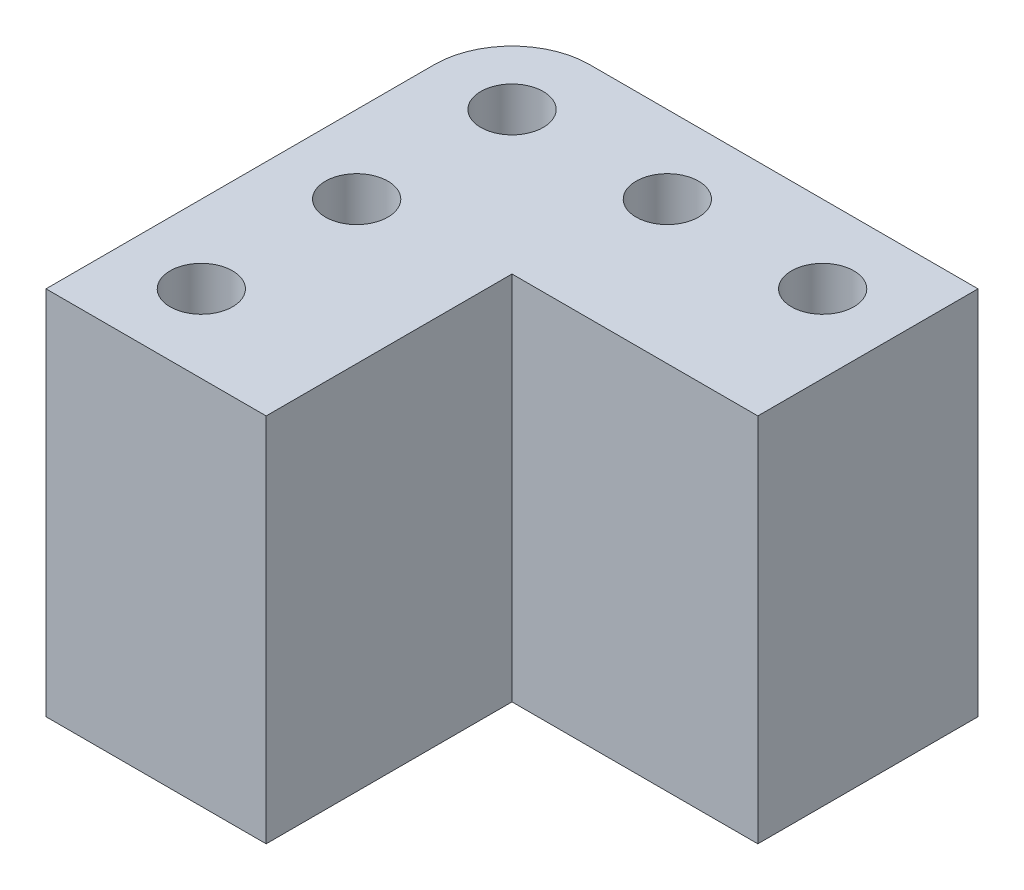
from build123d import *

# Parameters (mm, degrees)
BOSS_EXTRUDE1_DEPTH = 30.3
SKETCH2_R           = 2.5527
CUT_EXTRUDE1_DEPTH  = 62.816745304
CUT_EXTRUDE2_DEPTH  = 62.816745304


with BuildPart() as part:
    # Sketch1 → Boss-Extrude1 (new body)
    with BuildSketch(Plane(origin=(0, 0, 0), x_dir=(1, 0, 0), z_dir=(0, 1, 0))):
        Polygon((0, 0), (38.1, 0), (38.1, -18), (18, -18), (18, -38.1), (0, -38.1), align=None)
    extrude(amount=BOSS_EXTRUDE1_DEPTH)

    # Sketch2 → Cut-Extrude1 (cut, through all)
    with BuildSketch(Plane(origin=(0, 30.3, 0), x_dir=(1, 0, 0), z_dir=(0, 1, 0))):
        with Locations(Location((6.35, -6.35, 0), (0, 0, 270))):
            Circle(SKETCH2_R)
        with Locations(Location((19.05, -6.35, 0), (0, 0, 270))):
            Circle(SKETCH2_R)
        with Locations(Location((31.75, -6.35, 0), (0, 0, 270))):
            Circle(SKETCH2_R)
        with Locations(Location((6.35, -19.05, 0), (0, 0, 270))):
            Circle(SKETCH2_R)
        with Locations(Location((6.35, -31.75, 0), (0, 0, 270))):
            Circle(SKETCH2_R)
    extrude(amount=-CUT_EXTRUDE1_DEPTH, mode=Mode.SUBTRACT)

    # Sketch3 → Cut-Extrude2 (cut, through all)
    with BuildSketch(Plane(origin=(0, 30.3, 0), x_dir=(1, 0, 0), z_dir=(0, 1, 0))):
        with BuildLine():
            Line((0, -6.35), (-3.023343313, -6.35))
            Line((-3.023343313, -6.35), (-3.023343313, 2.931868043))
            Line((-3.023343313, 2.931868043), (6.35, 2.931868043))
            Line((6.35, 2.931868043), (6.35, 0))
            ThreePointArc((6.35, 0), (1.859871939, -1.859871939), (0, -6.35))
        make_face()
    extrude(amount=-CUT_EXTRUDE2_DEPTH, mode=Mode.SUBTRACT)


solid = part.part
